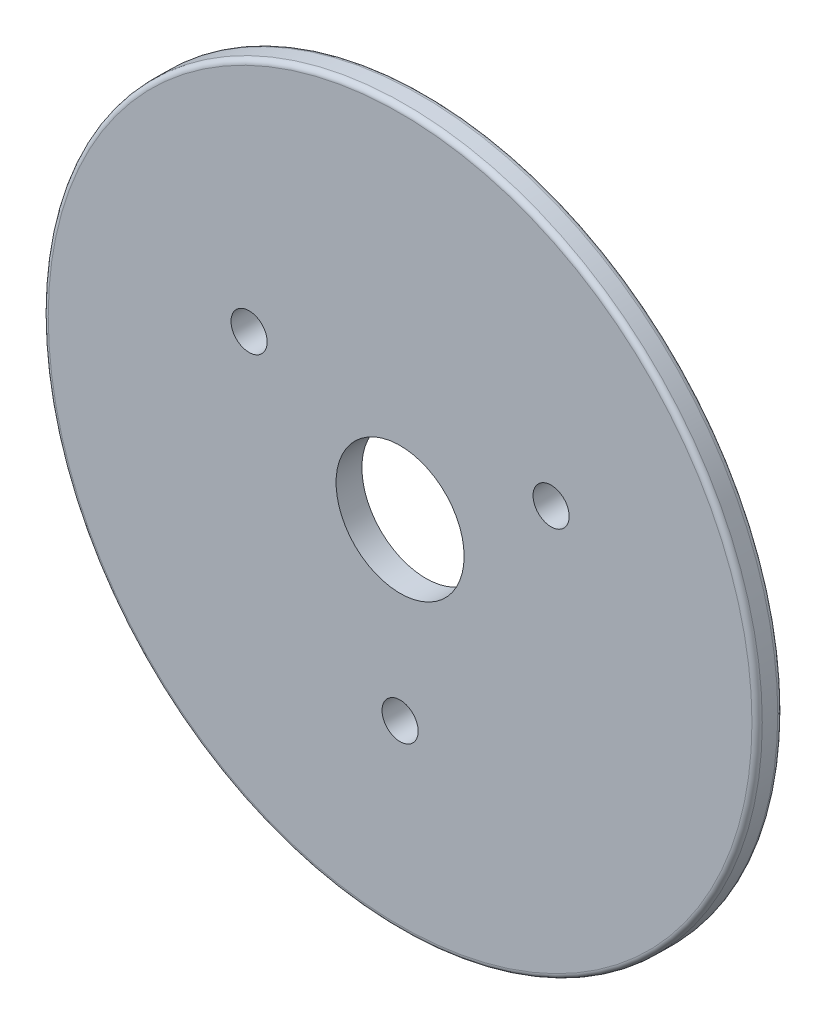
from build123d import *

# Parameters (mm, degrees)
BOSS_EXTRUDE1_DEPTH      = 7.25
BOSS_EXTRUDE1_DEPTH_BACK = 7.25
SKETCH7_R                = 29.575653678
CUT_EXTRUDE3_DEPTH       = 46.53502587
CUT_EXTRUDE3_DEPTH_BACK  = 46.53502587
SKETCH15_R               = 8.008120878
SKETCH15_R_2             = 2.25
BOSS_EXTRUDE2_DEPTH      = 5.5
SKETCH16_R               = 5
CUT_EXTRUDE4_DEPTH       = 3
BOSS_EXTRUDE3_START      = 7.5
SKETCH17_R               = 29.575653678
SKETCH17_R_2             = 5
BOSS_EXTRUDE3_DEPTH      = 7.5
CUT_EXTRUDE2_DEPTH       = 46.53502587
CUT_EXTRUDE2_DEPTH_BACK  = 46.53502587
FILLET2_R                = 0.51
BOSS_EXTRUDE4_START      = 2.5
SKETCH18_R               = 34.575653678
SKETCH18_R_2             = 29.575653678
SKETCH18_R_3             = 5
BOSS_EXTRUDE4_DEPTH      = 2.5
BOSS_EXTRUDE5_START      = -2.5
SKETCH19_R               = 34.575653678
SKETCH19_R_2             = 19
BOSS_EXTRUDE5_DEPTH      = 2.5
CUT_EXTRUDE5_DEPTH       = 61.27863763
FILLET3_R                = 0.5
SKETCH21_R               = 8.008120878
SKETCH21_R_2             = 6.2
SKETCH21_R_3             = 2.25
BOSS_EXTRUDE6_DEPTH      = 2.5
SKETCH21_4_R             = 8.008120878
SKETCH21_4_R_2           = 6.2
BOSS_EXTRUDE7_DEPTH      = 12
CUT_EXTRUDE7_DEPTH       = 10
CUT_EXTRUDE7_DEPTH_BACK  = 59.851628423
SKETCH23_R               = 1.75
CUT_EXTRUDE8_DEPTH       = 3
SKETCH25_R               = 1.75
BOSS_EXTRUDE8_DEPTH      = 0.2
CUT_EXTRUDE10_DEPTH      = 53.105198062
CUT_EXTRUDE10_DEPTH_BACK = 53.105198062
SKETCH22_W               = 69.151307356
SKETCH22_H               = 32.75


with BuildPart() as part:
    # Sketch7 → Boss-Extrude1 (new, two sides: drawn at the far end of the back side and taken through both)
    with BuildSketch(Plane.XY.offset(-BOSS_EXTRUDE1_DEPTH_BACK)):
        Circle(SKETCH7_R)
    extrude(amount=BOSS_EXTRUDE1_DEPTH + BOSS_EXTRUDE1_DEPTH_BACK)

    # Sketch14 → Revolve1 (revolve)
    with BuildSketch(Plane(origin=(0, 0, 0), x_dir=(0, 0, -1), z_dir=(1, 0, 0)), mode=Mode.PRIVATE) as revolve1_sk:
        Polygon((-18, 6.739517467), (-18, 0), (0, 0), (0, 19), (-3.355534752, 19), (-11.020158508, 12.583105693), align=None)
        with BuildLine():
            ThreePointArc((-7.25, 19), (-8.580081567, 15.465471544), (-11.020158508, 12.583105693))
            Line((-11.020158508, 12.583105693), (-3.355534752, 19))
            Line((-3.355534752, 19), (-7.25, 19))
        make_face()
        with BuildLine():
            Line((-18, 10), (-18, 6.739517467))
            Line((-18, 6.739517467), (-11.020158508, 12.583105693))
            ThreePointArc((-11.020158508, 12.583105693), (-14.286666254, 10.687865845), (-18, 10))
        make_face()
    revolve(revolve1_sk.sketch.rotate(Axis((0, 0, -36.129595921), (0, 0, 1)), 270), axis=Axis((0, 0, -36.129595921), (0, 0, 1)))

    # Sketch10 → Cut-Extrude3 (cut, two sides: drawn at the far end of the back side and taken through both)
    with BuildSketch(Plane.XY.offset(-CUT_EXTRUDE3_DEPTH_BACK)):
        with BuildLine():
            Line((2.2, 7.7), (-2.2, 7.7))
            Line((-2.2, 7.7), (-2.2, 5.796550698))
            ThreePointArc((-2.2, 5.796550698), (0, 6.2), (2.2, 5.796550698))
            Line((2.2, 5.796550698), (2.2, 7.7))
        make_face()
        with BuildLine():
            ThreePointArc((2.2, 5.796550698), (0, 6.2), (-2.2, 5.796550698))
            Line((-2.2, 5.796550698), (-2.2, 0))
            Line((-2.2, 0), (2.2, 0))
            Line((2.2, 0), (2.2, 5.796550698))
        make_face()
        with BuildLine():
            Line((-2.2, 0), (-2.2, 5.796550698))
            ThreePointArc((-2.2, 5.796550698), (-3.521363372, -5.102940329), (6.2, 0))
            ThreePointArc((6.2, 0), (5.102940329, 3.521363372), (2.2, 5.796550698))
            Line((2.2, 5.796550698), (2.2, 0))
            Line((2.2, 0), (-2.2, 0))
        make_face()
    extrude(amount=CUT_EXTRUDE3_DEPTH + CUT_EXTRUDE3_DEPTH_BACK, mode=Mode.SUBTRACT)

    # Sketch15 → Boss-Extrude2 (add)
    with BuildSketch(Plane(origin=(0, 0, -7.25), x_dir=(-1, 0, 0), z_dir=(0, 0, -1))):
        Circle(SKETCH15_R)
        Circle(SKETCH15_R_2, mode=Mode.SUBTRACT)
    extrude(amount=-BOSS_EXTRUDE2_DEPTH)

    # Sketch16 → Cut-Extrude4 (cut)
    with BuildSketch(Plane(origin=(0, 0, -7.25), x_dir=(-1, 0, 0), z_dir=(0, 0, -1))):
        Circle(SKETCH16_R)
    extrude(amount=-CUT_EXTRUDE4_DEPTH, mode=Mode.SUBTRACT)

    # Sketch17 → Boss-Extrude3 (add)
    with BuildSketch(Plane(origin=(0, 0, -7.25), x_dir=(-1, 0, 0), z_dir=(0, 0, -1)).offset(BOSS_EXTRUDE3_START)):
        with Locations(Location((0, 0, 0), (0, 0, 180))):
            Circle(SKETCH17_R)
        Circle(SKETCH17_R_2, mode=Mode.SUBTRACT)
    extrude(amount=-BOSS_EXTRUDE3_DEPTH)

    # Sketch8 → Cut-Extrude2 (cut, two sides: drawn at the far end of the back side and taken through both)
    with BuildSketch(Plane.XY.offset(-CUT_EXTRUDE2_DEPTH_BACK)):
        Polygon((-1.629816853, 27.574125652), (-2.358313477, 29.575653678), (2.358313477, 29.575653678), (1.629816853, 27.574125652), align=None)
        Polygon((6.970825494, 26.728192988), (6.896490207, 28.856877097), (11.382269006, 27.399359212), (10.07092137, 25.720910778), align=None)
        Polygon((14.889114872, 23.265918568), (15.476217378, 25.313388327), (19.29204874, 22.541024563), (17.526213935, 21.349953948), align=None)
        Polygon((21.349953948, 17.526213935), (22.541024563, 19.29204874), (25.313388327, 15.476217378), (23.265918568, 14.889114872), align=None)
        Polygon((25.720910778, 10.07092137), (27.399359212, 11.382269006), (28.856877097, 6.896490207), (26.728192988, 6.970825494), align=None)
        Polygon((27.574125652, 1.629816853), (29.575653678, 2.358313477), (29.575653678, -2.358313477), (27.574125652, -1.629816853), align=None)
        Polygon((26.728192988, -6.970825494), (28.856877097, -6.896490207), (27.399359212, -11.382269006), (25.720910778, -10.07092137), align=None)
        Polygon((23.265918568, -14.889114872), (25.313388327, -15.476217378), (22.541024563, -19.29204874), (21.349953948, -17.526213935), align=None)
        Polygon((17.526213935, -21.349953948), (19.29204874, -22.541024563), (15.476217378, -25.313388327), (14.889114872, -23.265918568), align=None)
        Polygon((10.07092137, -25.720910778), (11.382269006, -27.399359212), (6.896490207, -28.856877097), (6.970825494, -26.728192988), align=None)
        Polygon((1.629816853, -27.574125652), (2.358313477, -29.575653678), (-2.358313477, -29.575653678), (-1.629816853, -27.574125652), align=None)
        Polygon((-6.970825494, -26.728192988), (-6.896490207, -28.856877097), (-11.382269006, -27.399359212), (-10.07092137, -25.720910778), align=None)
        Polygon((-14.889114872, -23.265918568), (-15.476217378, -25.313388327), (-19.29204874, -22.541024563), (-17.526213935, -21.349953948), align=None)
        Polygon((-21.349953948, -17.526213935), (-22.541024563, -19.29204874), (-25.313388327, -15.476217378), (-23.265918568, -14.889114872), align=None)
        Polygon((-25.720910778, -10.07092137), (-27.399359212, -11.382269006), (-28.856877097, -6.896490207), (-26.728192988, -6.970825494), align=None)
        Polygon((-27.574125652, -1.629816853), (-29.575653678, -2.358313477), (-29.575653678, 2.358313477), (-27.574125652, 1.629816853), align=None)
        Polygon((-26.728192988, 6.970825494), (-28.856877097, 6.896490207), (-27.399359212, 11.382269006), (-25.720910778, 10.07092137), align=None)
        Polygon((-23.265918568, 14.889114872), (-25.313388327, 15.476217378), (-22.541024563, 19.29204874), (-21.349953948, 17.526213935), align=None)
        Polygon((-17.526213935, 21.349953948), (-19.29204874, 22.541024563), (-15.476217378, 25.313388327), (-14.889114872, 23.265918568), align=None)
        Polygon((-10.07092137, 25.720910778), (-11.382269006, 27.399359212), (-6.896490207, 28.856877097), (-6.970825494, 26.728192988), align=None)
    extrude(amount=CUT_EXTRUDE2_DEPTH + CUT_EXTRUDE2_DEPTH_BACK, mode=Mode.SUBTRACT)

    # Fillet2
    fillet2_edges = [part.edges().sort_by_distance(p)[0] for p in [
        (-27.322605317, -11.322302291, -3.75),
        (-28.759534341, -6.89988949, -3.75),
        (-26.728192988, -6.970825494, -3.75),
        (-25.720910778, -10.07092137, -3.75),
        (-22.486558005, -19.211298747, -3.75),
        (-25.219759429, -15.449369723, -3.75),
        (-23.265918568, -14.889114872, -3.75),
        (-21.349953948, -17.526213935, -3.75),
        (-15.449369723, -25.219759429, -3.75),
        (-19.211298747, -22.486558005, -3.75),
        (-17.526213935, -21.349953948, -3.75),
        (-14.889114872, -23.265918568, -3.75),
        (-6.89988949, -28.759534341, -3.75),
        (-11.322302291, -27.322605317, -3.75),
        (-10.07092137, -25.720910778, -3.75),
        (-6.970825494, -26.728192988, -3.75),
        (2.325, -29.484125652, -3.75),
        (-2.325, -29.484125652, -3.75),
        (-1.629816853, -27.574125652, -3.75),
        (1.629816853, -27.574125652, -3.75),
        (11.322302291, -27.322605317, -3.75),
        (6.89988949, -28.759534341, -3.75),
        (6.970825494, -26.728192988, -3.75),
        (10.07092137, -25.720910778, -3.75),
        (19.211298747, -22.486558005, -3.75),
        (15.449369723, -25.219759429, -3.75),
        (14.889114872, -23.265918568, -3.75),
        (17.526213935, -21.349953948, -3.75),
        (25.219759429, -15.449369723, -3.75),
        (22.486558005, -19.211298747, -3.75),
        (21.349953948, -17.526213935, -3.75),
        (23.265918568, -14.889114872, -3.75),
        (28.759534341, -6.89988949, -3.75),
        (27.322605317, -11.322302291, -3.75),
        (25.720910778, -10.07092137, -3.75),
        (26.728192988, -6.970825494, -3.75),
        (29.484125652, 2.325, -3.75),
        (29.484125652, -2.325, -3.75),
        (27.574125652, -1.629816853, -3.75),
        (27.574125652, 1.629816853, -3.75),
        (27.322605317, 11.322302291, -3.75),
        (28.759534341, 6.89988949, -3.75),
        (26.728192988, 6.970825494, -3.75),
        (25.720910778, 10.07092137, -3.75),
        (22.486558005, 19.211298747, -3.75),
        (25.219759429, 15.449369723, -3.75),
        (23.265918568, 14.889114872, -3.75),
        (21.349953948, 17.526213935, -3.75),
        (15.449369723, 25.219759429, -3.75),
        (19.211298747, 22.486558005, -3.75),
        (17.526213935, 21.349953948, -3.75),
        (14.889114872, 23.265918568, -3.75),
        (6.89988949, 28.759534341, -3.75),
        (11.322302291, 27.322605317, -3.75),
        (10.07092137, 25.720910778, -3.75),
        (6.970825494, 26.728192988, -3.75),
        (-28.759534341, 6.89988949, -3.75),
        (-27.322605317, 11.322302291, -3.75),
        (-25.720910778, 10.07092137, -3.75),
        (-26.728192988, 6.970825494, -3.75),
        (-29.484125652, -2.325, -3.75),
        (-29.484125652, 2.325, -3.75),
        (-27.574125652, 1.629816853, -3.75),
        (-27.574125652, -1.629816853, -3.75),
        (-25.219759429, 15.449369723, -3.75),
        (-22.486558005, 19.211298747, -3.75),
        (-21.349953948, 17.526213935, -3.75),
        (-23.265918568, 14.889114872, -3.75),
        (-19.211298747, 22.486558005, -3.75),
        (-15.449369723, 25.219759429, -3.75),
        (-14.889114872, 23.265918568, -3.75),
        (-17.526213935, 21.349953948, -3.75),
        (-11.322302291, 27.322605317, -3.75),
        (-6.89988949, 28.759534341, -3.75),
        (-6.970825494, 26.728192988, -3.75),
        (-10.07092137, 25.720910778, -3.75),
        (-2.325, 29.484125652, -3.75),
        (2.325, 29.484125652, -3.75),
        (1.629816853, 27.574125652, -3.75),
        (-1.629816853, 27.574125652, -3.75),
    ]]
    fillet(fillet2_edges, radius=FILLET2_R)

    # Sketch18 → Boss-Extrude4 (add)
    # profile 1 of 2: a face of its own
    with BuildSketch(Plane(origin=(0, 0, -14.75), x_dir=(-1, 0, 0), z_dir=(0, 0, -1)).offset(BOSS_EXTRUDE4_START)):
        Circle(SKETCH18_R)
        Circle(SKETCH18_R_2, mode=Mode.SUBTRACT)
    # profile 2 of 2: a face of its own
    with BuildSketch(Plane(origin=(0, 0, -14.75), x_dir=(-1, 0, 0), z_dir=(0, 0, -1)).offset(BOSS_EXTRUDE4_START)):
        Circle(SKETCH18_R_2)
        Circle(SKETCH18_R_3, mode=Mode.SUBTRACT)
    extrude(amount=-BOSS_EXTRUDE4_DEPTH)

    # Sketch19 → Boss-Extrude5 (add)
    with BuildSketch(Plane.XY.offset(7.25).offset(BOSS_EXTRUDE5_START)):
        with Locations(Location((0, 0, 0), (0, 0, 180))):
            Circle(SKETCH19_R)
        Circle(SKETCH19_R_2, mode=Mode.SUBTRACT)
    extrude(amount=BOSS_EXTRUDE5_DEPTH)

    # Sketch20 → Cut-Extrude5 (cut, through all)
    with BuildSketch(Plane.XY.offset(18)):
        with BuildLine():
            Line((-2.2, 7.7), (-2.2, 5.796550698))
            ThreePointArc((-2.2, 5.796550698), (0, 6.2), (2.2, 5.796550698))
            Line((2.2, 5.796550698), (2.2, 7.7))
            Line((2.2, 7.7), (-2.2, 7.7))
        make_face()
        with BuildLine():
            ThreePointArc((2.2, 5.796550698), (0, 6.2), (-2.2, 5.796550698))
            ThreePointArc((-2.2, 5.796550698), (-3.521363372, -5.102940329), (6.2, 0))
            ThreePointArc((6.2, 0), (5.102940329, 3.521363372), (2.2, 5.796550698))
        make_face()
    extrude(amount=-CUT_EXTRUDE5_DEPTH, mode=Mode.SUBTRACT)

    # Fillet3
    fillet3_edges = [part.edges().sort_by_distance(p)[0] for p in [
        (34.575653678, 0, 4.75),
        (34.575653678, 0, 7.25),
        (0, 7.7, 18),
        (2.2, 6.748275349, 18),
        (-2.2, 6.748275349, 18),
        (0, -6.2, 18),
        (2.2, 5.796550698, 0.375),
        (-2.2, 5.796550698, 0.375),
        (-19, 0, 7.25),
        (-10, 0, 18),
        (34.575653678, 0, -14.75),
        (34.575653678, 0, -17.25),
    ]]
    fillet(fillet3_edges, radius=FILLET3_R)

    # Sketch21 → Boss-Extrude6 (add)
    # profile 1 of 2: a face of its own
    with BuildSketch(Plane.XY.offset(-5.25)):
        Circle(SKETCH21_R)
        Circle(SKETCH21_R_2, mode=Mode.SUBTRACT)
    # profile 2 of 2: a face of its own
    with BuildSketch(Plane.XY.offset(-5.25)):
        Circle(SKETCH21_R_2)
        Circle(SKETCH21_R_3, mode=Mode.SUBTRACT)
    extrude(amount=-BOSS_EXTRUDE6_DEPTH)

    # Sketch21<4> → Boss-Extrude7 (add)
    with BuildSketch(Plane.XY.offset(-5.25)):
        Circle(SKETCH21_4_R)
        Circle(SKETCH21_4_R_2, mode=Mode.SUBTRACT)
    extrude(amount=-BOSS_EXTRUDE7_DEPTH)

    # Sketch23 → Cut-Extrude7 (cut, two sides: drawn at the far end of the back side and taken through both)
    with BuildSketch(Plane.XY.offset(-14.75).offset(-CUT_EXTRUDE7_DEPTH_BACK)):
        with Locations((0, -16.887062826)):
            Circle(SKETCH23_R)
        with Locations((-14.624625403, 8.443531413)):
            Circle(SKETCH23_R)
        with Locations((14.624625403, 8.443531413)):
            Circle(SKETCH23_R)
    extrude(amount=CUT_EXTRUDE7_DEPTH + CUT_EXTRUDE7_DEPTH_BACK, mode=Mode.SUBTRACT)

    # Sketch24 → Cut-Extrude8 (cut)
    with BuildSketch(Plane.XY.offset(-12.25)):
        Polygon((-14.624625403, 5.094899852), (-11.724625403, 6.769215632), (-11.724625403, 10.117847194), (-14.624625403, 11.792162974), (-17.524625403, 10.117847194), (-17.524625403, 6.769215632), align=None)
        Polygon((2.9, -18.561378607), (2.9, -15.212747045), (0, -13.538431265), (-2.9, -15.212747045), (-2.9, -18.561378607), (0, -20.235694387), align=None)
        Polygon((14.624625403, 5.094899852), (17.524625403, 6.769215632), (17.524625403, 10.117847194), (14.624625403, 11.792162974), (11.724625403, 10.117847194), (11.724625403, 6.769215632), align=None)
    extrude(amount=CUT_EXTRUDE8_DEPTH, mode=Mode.SUBTRACT)

    # Sketch25 → Boss-Extrude8 (add)
    with BuildSketch(Plane(origin=(0, 0, -9.25), x_dir=(-1, 0, 0), z_dir=(0, 0, -1))):
        with Locations(Location((0, -16.887062826, 0), (0, 0, 180))):
            Circle(SKETCH25_R)
        with Locations(Location((14.624625403, 8.443531413, 0), (0, 0, 180))):
            Circle(SKETCH25_R)
        with Locations(Location((-14.624625403, 8.443531413, 0), (0, 0, 180))):
            Circle(SKETCH25_R)
    extrude(amount=-BOSS_EXTRUDE8_DEPTH)

    # Sketch22 → Cut-Extrude10 (cut, two sides: drawn at the far end of the back side and taken through both)
    with BuildSketch(Plane(origin=(0, 0, 0), x_dir=(1, 0, 0), z_dir=(0, 1, 0)).offset(-CUT_EXTRUDE10_DEPTH_BACK)):
        with Locations((0, -1.625)):
            Rectangle(SKETCH22_W, SKETCH22_H)
    extrude(amount=CUT_EXTRUDE10_DEPTH + CUT_EXTRUDE10_DEPTH_BACK, mode=Mode.SUBTRACT)


solid = part.part
